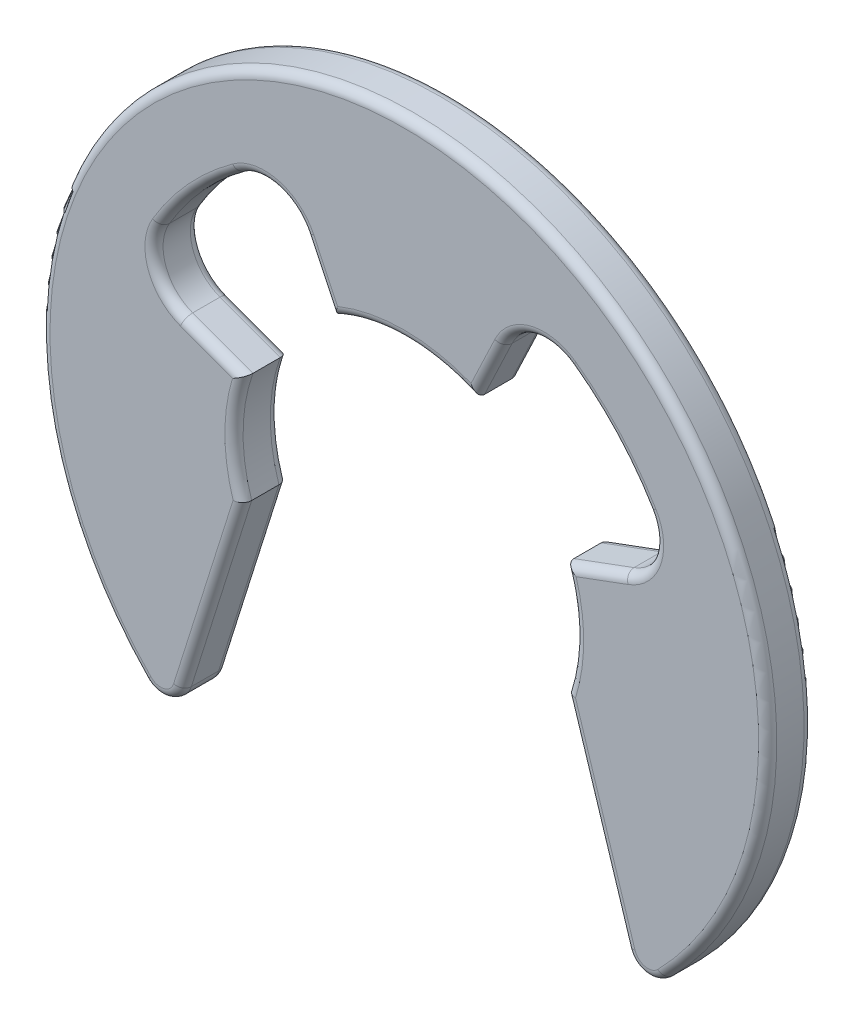
from build123d import *

# Parameters (mm, degrees)
EXTRUSION1_DEPTH = 1
CONG_1_R         = 0.2


with BuildPart() as part:
    # Esquisse1 → Extrusion1 (new body)
    with BuildSketch(Plane.XY):
        with BuildLine():
            Line((1.567339183, 3.406750341), (2.17332983, 4.682952759))
            ThreePointArc((2.17332983, 4.682952759), (2.828616778, 5.222762649), (3.662694882, 5.064303131))
            ThreePointArc((3.662694882, 5.064303131), (4.611336081, 4.218777021), (5.369345735, 3.198847664))
            ThreePointArc((5.369345735, 3.198847664), (5.45316543, 2.353998589), (4.857336037, 1.749198592))
            Line((4.857336037, 1.749198592), (3.532393676, 1.258846662))
            ThreePointArc((3.532393676, 1.258846662), (3.749766965, 0.041805581), (3.559581546, -1.17977931))
            Line((3.559581546, -1.17977931), (4.887496838, -5.391867605))
            ThreePointArc((4.887496838, -5.391867605), (5.24832354, -5.727879403), (5.721984232, -5.59096561))
            ThreePointArc((5.721984232, -5.59096561), (0, 8), (-5.721984232, -5.59096561))
            ThreePointArc((-5.721984232, -5.59096561), (-5.24832354, -5.727879403), (-4.887496838, -5.391867605))
            Line((-4.887496838, -5.391867605), (-3.559581546, -1.17977931))
            ThreePointArc((-3.559581546, -1.17977931), (-3.749766965, 0.041805581), (-3.532393676, 1.258846662))
            Line((-3.532393676, 1.258846662), (-4.857336037, 1.749198592))
            ThreePointArc((-4.857336037, 1.749198592), (-5.45316543, 2.353998589), (-5.369345735, 3.198847664))
            ThreePointArc((-5.369345735, 3.198847664), (-4.611336081, 4.218777021), (-3.662694882, 5.064303131))
            ThreePointArc((-3.662694882, 5.064303131), (-2.828616778, 5.222762649), (-2.17332983, 4.682952759))
            Line((-2.17332983, 4.682952759), (-1.567339183, 3.406750341))
            ThreePointArc((-1.567339183, 3.406750341), (0, 3.75), (1.567339183, 3.406750341))
        make_face()
    extrude(amount=EXTRUSION1_DEPTH)

    # Congé1
    cong_1_edges = [part.edges().sort_by_distance(p)[0] for p in [
        (-2.828616778, 5.222762649, 0),
        (-2.828616778, 5.222762649, 1),
        (-1.870334507, 4.04485155, 0),
        (-1.870334507, 4.04485155, 1),
        (0, 3.75, 0),
        (0, 3.75, 1),
        (1.870334507, 4.04485155, 0),
        (1.870334507, 4.04485155, 1),
        (2.828616778, 5.222762649, 0),
        (2.828616778, 5.222762649, 1),
        (4.611336081, 4.218777021, 0),
        (4.611336081, 4.218777021, 1),
        (5.45316543, 2.353998589, 0),
        (5.45316543, 2.353998589, 1),
        (4.194864856, 1.504022627, 0),
        (4.194864856, 1.504022627, 1),
        (3.749766965, 0.041805581, 0),
        (3.749766965, 0.041805581, 1),
        (4.223539192, -3.285823458, 0),
        (4.223539192, -3.285823458, 1),
        (5.24832354, -5.727879403, 0),
        (5.24832354, -5.727879403, 1),
        (0, 8, 0),
        (0, 8, 1),
        (-5.24832354, -5.727879403, 0),
        (-5.24832354, -5.727879403, 1),
        (-4.223539192, -3.285823458, 0),
        (-4.223539192, -3.285823458, 1),
        (-3.749766965, 0.041805581, 0),
        (-3.749766965, 0.041805581, 1),
        (-4.194864856, 1.504022627, 0),
        (-4.194864856, 1.504022627, 1),
        (-5.45316543, 2.353998589, 0),
        (-5.45316543, 2.353998589, 1),
        (-4.611336081, 4.218777021, 0),
        (-4.611336081, 4.218777021, 1),
    ]]
    fillet(cong_1_edges, radius=CONG_1_R)


solid = part.part
